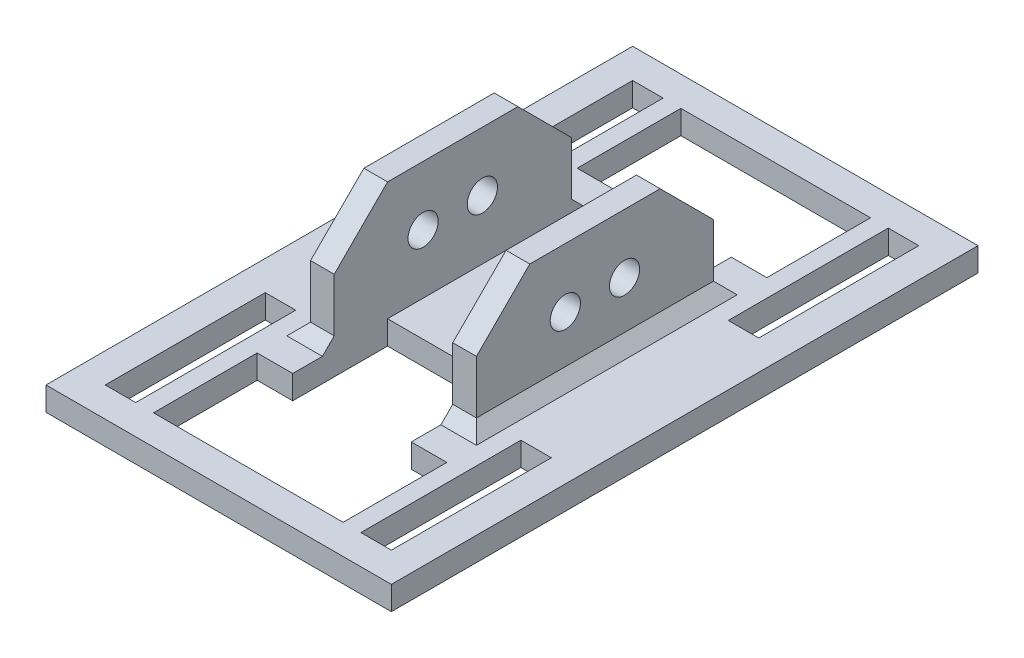
from build123d import *

# Parameters (mm, degrees)
SKETCH1_W           = 58.28
SKETCH1_H           = 99
SKETCH1_W_2         = 5.14
SKETCH1_H_2         = 27
BOSS_EXTRUDE1_DEPTH = 4
SKETCH2_W           = 4
SKETCH2_H           = 40
BOSS_EXTRUDE2_DEPTH = 20
CUT_EXTRUDE1_REACH  = 108.175
SKETCH3_R           = 2.55
CHAMFER1_SIZE       = 2
CUT_EXTRUDE2_REACH  = 108.175
CUT_EXTRUDE3_DEPTH  = 4


with BuildPart() as part:
    # Sketch1 → Boss-Extrude1 (new body)
    with BuildSketch(Plane(origin=(0, 0, 0), x_dir=(1, 0, 0), z_dir=(0, 1, 0))):
        with Locations((24.14, 44.5)):
            Rectangle(SKETCH1_W, SKETCH1_H)
        with Locations((2.57, 75.5)):
            Rectangle(SKETCH1_W_2, SKETCH1_H_2, mode=Mode.SUBTRACT)
        with Locations((45.71, 75.5)):
            Rectangle(SKETCH1_W_2, SKETCH1_H_2, mode=Mode.SUBTRACT)
        with Locations((2.57, 13.5)):
            Rectangle(SKETCH1_W_2, SKETCH1_H_2, mode=Mode.SUBTRACT)
        with Locations((45.71, 13.5)):
            Rectangle(SKETCH1_W_2, SKETCH1_H_2, mode=Mode.SUBTRACT)
    extrude(amount=BOSS_EXTRUDE1_DEPTH)

    # Sketch2 → Boss-Extrude2 (add)
    with BuildSketch(Plane(origin=(0, 4, 0), x_dir=(1, 0, 0), z_dir=(0, 1, 0))):
        with Locations((12.14, 44.5)):
            Rectangle(SKETCH2_W, SKETCH2_H)
        with Locations((36.14, 44.5)):
            Rectangle(SKETCH2_W, SKETCH2_H)
    extrude(amount=BOSS_EXTRUDE2_DEPTH)

    # Cut-Extrude1: up to this face of the body (flat: up to its plane)
    cut_extrude1_end = Plane(part.part.faces().sort_by_distance((10.14, 14, -44.5))[0])
    # Sketch3 → Cut-Extrude1 (cut, up to the picked face)
    with BuildSketch(Plane(origin=(38.14, 0, 0), x_dir=(0, 0, -1), z_dir=(1, 0, 0)), mode=Mode.PRIVATE) as cut_extrude1_sk1:
        with Locations((39.5, 14)):
            Circle(SKETCH3_R)
    cut_extrude1_tool1 = split(extrude(cut_extrude1_sk1.sketch, amount=-CUT_EXTRUDE1_REACH, mode=Mode.PRIVATE), bisect_by=cut_extrude1_end, keep=Keep.BOTH, mode=Mode.PRIVATE)
    # Sketch3 → Cut-Extrude1 (cut, up to the picked face)
    with BuildSketch(Plane(origin=(38.14, 0, 0), x_dir=(0, 0, -1), z_dir=(1, 0, 0)), mode=Mode.PRIVATE) as cut_extrude1_sk2:
        with Locations((49.5, 14)):
            Circle(SKETCH3_R)
    cut_extrude1_tool2 = split(extrude(cut_extrude1_sk2.sketch, amount=-CUT_EXTRUDE1_REACH, mode=Mode.PRIVATE), bisect_by=cut_extrude1_end, keep=Keep.BOTH, mode=Mode.PRIVATE)
    add(cut_extrude1_tool1.solids().sort_by(Axis((38.14, 14, -39.5), (-1, 0, 0)))[0], mode=Mode.SUBTRACT)
    add(cut_extrude1_tool2.solids().sort_by(Axis((38.14, 14, -49.5), (-1, 0, 0)))[0], mode=Mode.SUBTRACT)

    # Chamfer1
    chamfer1_edges = [part.edges().sort_by_distance(p)[0] for p in [
        (12.14, 4, -64.5),
        (10.14, 4, -44.5),
        (12.14, 4, -24.5),
        (36.14, 4, -24.5),
        (38.14, 4, -44.5),
        (36.14, 4, -64.5),
    ]]
    chamfer(chamfer1_edges, length=CHAMFER1_SIZE)

    # Cut-Extrude2: up to this face of the body (flat: up to its plane)
    cut_extrude2_end = Plane(part.part.faces().sort_by_distance((38.14, 15.060158725, -44.5))[0])
    # Sketch4 → Cut-Extrude2 (cut, up to the picked face)
    with BuildSketch(Plane.ZY.offset(-10.14), mode=Mode.PRIVATE) as cut_extrude2_sk1:
        Polygon((-55.5, 24), (-64.5, 15), (-64.5, 24), align=None)
    cut_extrude2_tool1 = split(extrude(cut_extrude2_sk1.sketch, amount=-CUT_EXTRUDE2_REACH, mode=Mode.PRIVATE), bisect_by=cut_extrude2_end, keep=Keep.BOTH, mode=Mode.PRIVATE)
    # Sketch4 → Cut-Extrude2 (cut, up to the picked face)
    with BuildSketch(Plane.ZY.offset(-10.14), mode=Mode.PRIVATE) as cut_extrude2_sk2:
        Polygon((-33.5, 24), (-24.5, 15), (-24.5, 24), align=None)
    cut_extrude2_tool2 = split(extrude(cut_extrude2_sk2.sketch, amount=-CUT_EXTRUDE2_REACH, mode=Mode.PRIVATE), bisect_by=cut_extrude2_end, keep=Keep.BOTH, mode=Mode.PRIVATE)
    add(cut_extrude2_tool1.solids().sort_by(Axis((10.14, 21, -61.5), (1, 0, 0)))[0], mode=Mode.SUBTRACT)
    add(cut_extrude2_tool2.solids().sort_by(Axis((10.14, 21, -27.5), (1, 0, 0)))[0], mode=Mode.SUBTRACT)

    # Sketch5 → Cut-Extrude3 (cut)
    with BuildSketch(Plane(origin=(0, 4, 0), x_dir=(1, 0, 0), z_dir=(0, 1, 0))):
        Polygon((8.14, 89), (40.14, 89), (40.14, 71.5), (34.14, 71.5), (34.14, 55.5), (14.14, 55.5), (14.14, 71.5), (8.14, 71.5), align=None)
        Polygon((8.14, 0), (40.14, 0), (40.14, 17.5), (34.14, 17.5), (34.14, 33.5), (14.14, 33.5), (14.14, 17.5), (8.14, 17.5), align=None)
    extrude(amount=-CUT_EXTRUDE3_DEPTH, mode=Mode.SUBTRACT)


solid = part.part
